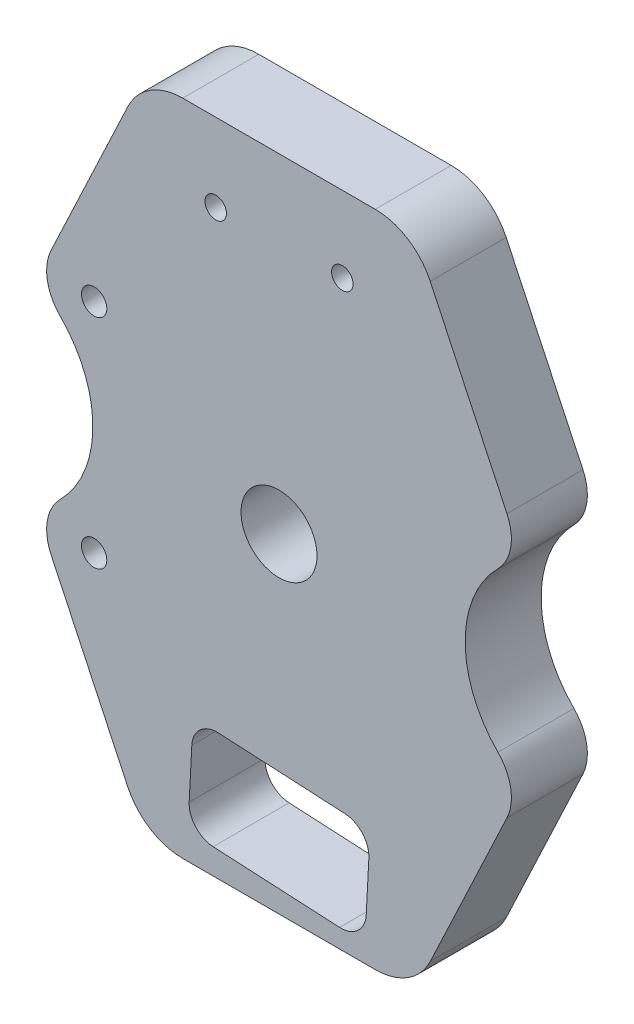
from build123d import *

# Parameters (mm, degrees)
SZKIC1_R                    = 15
SZKIC1_R_2                  = 5
SZKIC1_R_3                  = 4.25
DODANIE_WYCI_GNI_CIE1_DEPTH = 30
WYTNIJ_WYCI_GNI_CIE1_DEPTH  = 30
ZAOKR_GLENIE1_R             = 10


with BuildPart() as part:
    # Szkic1 → Dodanie-wyciągnięcie1 (new body)
    with BuildSketch(Plane.XY):
        with BuildLine():
            Line((-38, 260), (38, 260))
            ThreePointArc((38, 260), (50.853486978, 256.267902519), (59.709435091, 246.232322709))
            Line((59.709435091, 246.232322709), (90.008216267, 181.948831851))
            ThreePointArc((90.008216267, 181.948831851), (91.483769879, 171.062118236), (86.44222441, 161.300939461))
            ThreePointArc((86.44222441, 161.300939461), (73.499977081, 129.92645546), (86.44222441, 98.551971459))
            ThreePointArc((86.44222441, 98.551971459), (91.483769879, 88.790792684), (90.008216267, 77.904079069))
            Line((90.008216267, 77.904079069), (59.766160901, 13.740940677))
            ThreePointArc((59.766160901, 13.740940677), (50.88106069, 3.705595357), (38, 0))
            Line((38, 0), (0, 0))
            Line((0, 0), (-38, 0))
            ThreePointArc((-38, 0), (-50.88106069, 3.705595357), (-59.766160901, 13.740940677))
            Line((-59.766160901, 13.740940677), (-90.008216267, 77.904079069))
            ThreePointArc((-90.008216267, 77.904079069), (-91.483769879, 88.790792684), (-86.44222441, 98.551971459))
            ThreePointArc((-86.44222441, 98.551971459), (-73.499977081, 129.92645546), (-86.44222441, 161.300939461))
            ThreePointArc((-86.44222441, 161.300939461), (-91.483769879, 171.062118236), (-90.008216267, 181.948831851))
            Line((-90.008216267, 181.948831851), (-59.709435091, 246.232322709))
            ThreePointArc((-59.709435091, 246.232322709), (-50.853486978, 256.267902519), (-38, 260))
        make_face()
        with Locations((0, 130)):
            Circle(SZKIC1_R, mode=Mode.SUBTRACT)
        with Locations((-73, 87)):
            Circle(SZKIC1_R_2, mode=Mode.SUBTRACT)
        with Locations(Location((-73, 173, 0), (0, 0, 180))):
            Circle(SZKIC1_R_2, mode=Mode.SUBTRACT)
        with Locations((25, 230)):
            Circle(SZKIC1_R_3, mode=Mode.SUBTRACT)
        with Locations((-24.992384758, 229.127379678)):
            Circle(SZKIC1_R_3, mode=Mode.SUBTRACT)
        with Locations((-25, 30)):
            Circle(SZKIC1_R_3, mode=Mode.SUBTRACT)
        with Locations((24.931476738, 27.383202188)):
            Circle(SZKIC1_R_3, mode=Mode.SUBTRACT)
    extrude(amount=DODANIE_WYCI_GNI_CIE1_DEPTH)

    # Szkic4 → Wytnij-wyciągnięcie1 (cut)
    with BuildSketch(Plane(origin=(-86.44222441, 98.551971459, 0), x_dir=(-1, 0, 0), z_dir=(0, 0, -1))):
        Polygon((-52.536909819, -48.057816777), (-50.443471569, -88.002998167), (-120.347539002, -91.666515104), (-122.440977251, -51.721333714), align=None)
    extrude(amount=-WYTNIJ_WYCI_GNI_CIE1_DEPTH, mode=Mode.SUBTRACT)

    # Zaokrąglenie1
    zaokr_glenie1_edges = [part.edges().sort_by_distance(p)[0] for p in [
        (35.998752841, 46.830637745, 15),
        (-33.905314592, 50.494154682, 15),
        (-35.998752841, 10.548973291, 15),
        (33.905314592, 6.885456354, 15),
    ]]
    fillet(zaokr_glenie1_edges, radius=ZAOKR_GLENIE1_R)


solid = part.part
